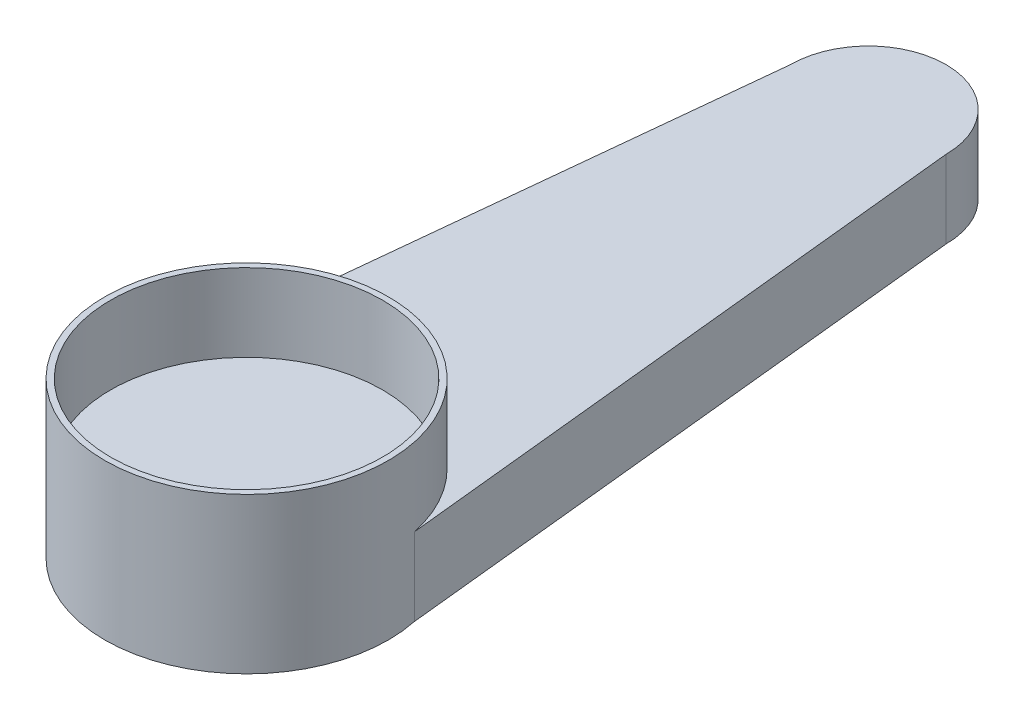
from build123d import *

# Parameters (mm, degrees)
BOSS_EXTRUDE1_DEPTH = 2
BOSS_EXTRUDE2_START = 2
SKETCH2_R           = 3.65
BOSS_EXTRUDE2_DEPTH = 2
SKETCH3_R           = 3.5
CUT_EXTRUDE1_DEPTH  = 2


with BuildPart() as part:
    # Sketch1 → Boss-Extrude1 (new body)
    with BuildSketch(Plane(origin=(0, 0, 0), x_dir=(1, 0, 0), z_dir=(0, 1, 0))):
        with BuildLine():
            Line((-3.57318314, -7.255109239), (-2, 8))
            ThreePointArc((-2, 8), (0, 10), (2, 8))
            Line((2, 8), (3.57318314, -7.255109239))
            ThreePointArc((3.57318314, -7.255109239), (0, -11.65), (-3.57318314, -7.255109239))
        make_face()
    extrude(amount=-BOSS_EXTRUDE1_DEPTH)

    # Sketch2 → Boss-Extrude2 (add)
    with BuildSketch(Plane(origin=(0, 0, 0), x_dir=(1, 0, 0), z_dir=(0, 1, 0)).offset(BOSS_EXTRUDE2_START)):
        with Locations(Location((0, -8, 0), (0, 0, 270))):
            Circle(SKETCH2_R)
    extrude(amount=-BOSS_EXTRUDE2_DEPTH)

    # Sketch3 → Cut-Extrude1 (cut)
    with BuildSketch(Plane(origin=(0, 2, 0), x_dir=(1, 0, 0), z_dir=(0, 1, 0))):
        with Locations(Location((0, -8, 0), (0, 0, 270))):
            Circle(SKETCH3_R)
    extrude(amount=-CUT_EXTRUDE1_DEPTH, mode=Mode.SUBTRACT)


solid = part.part
